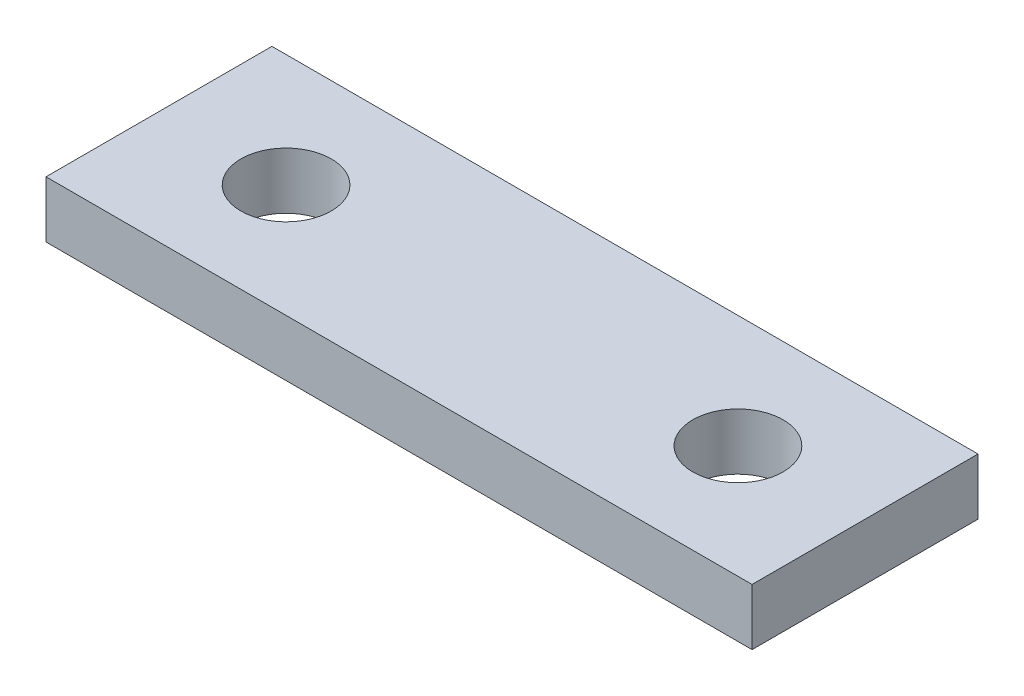
from build123d import *

# Parameters (mm, degrees)
SKETCH1_W           = 125
SKETCH1_H           = 40
SKETCH1_R           = 8
BOSS_EXTRUDE1_DEPTH = 10


with BuildPart() as part:
    # Sketch1 → Boss-Extrude1 (new body)
    with BuildSketch(Plane(origin=(0, 0, 0), x_dir=(1, 0, 0), z_dir=(0, 1, 0))):
        with Locations((62.5, 20)):
            Rectangle(SKETCH1_W, SKETCH1_H)
        with Locations(Location((22.5, 20, 0), (0, 0, 270))):
            Circle(SKETCH1_R, mode=Mode.SUBTRACT)
        with Locations(Location((102.5, 20, 0), (0, 0, 270))):
            Circle(SKETCH1_R, mode=Mode.SUBTRACT)
    extrude(amount=BOSS_EXTRUDE1_DEPTH)


solid = part.part
